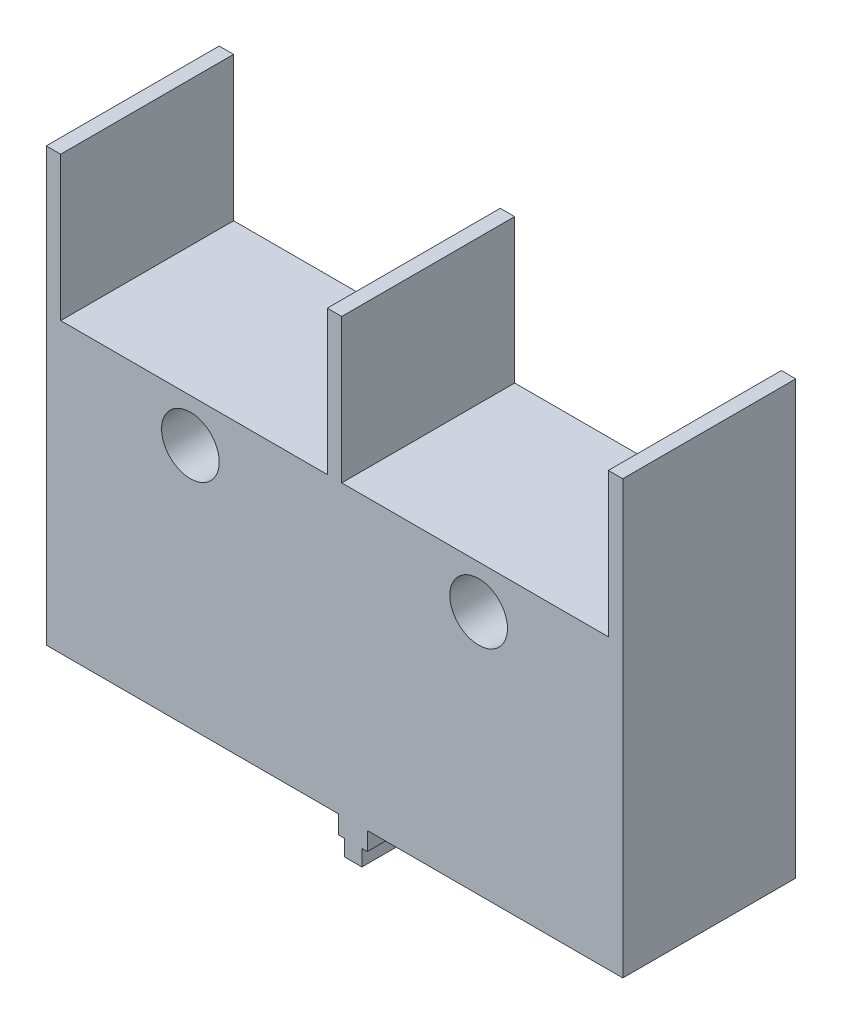
from build123d import *

# Parameters (mm, degrees)
ESQUISSE1_R        = 1
BOSS_EXTRU_1_DEPTH = 6


with BuildPart() as part:
    # Esquisse1 → Boss.-Extru.1 (new body)
    with BuildSketch(Plane.XY):
        Polygon((10.25, 10), (19.5, 10), (19.5, 15), (20, 15), (20, 10), (20, 0), (11.136405684, 0), (11.136405684, -0.631853681), (10.950128603, -0.631853681), (10.950128603, -1.190340031), (10.350128603, -1.190340031), (10.350128603, -0.631853681), (10.139980349, -0.631853681), (10.139980349, 0), (0, 0), (0, 10), (0, 15), (0.5, 15), (0.5, 10), (9.75, 10), (9.75, 15), (10.25, 15), align=None)
        with Locations((5, 8.5)):
            Circle(ESQUISSE1_R, mode=Mode.SUBTRACT)
        with Locations((15, 8.5)):
            Circle(ESQUISSE1_R, mode=Mode.SUBTRACT)
    extrude(amount=BOSS_EXTRU_1_DEPTH)


solid = part.part
